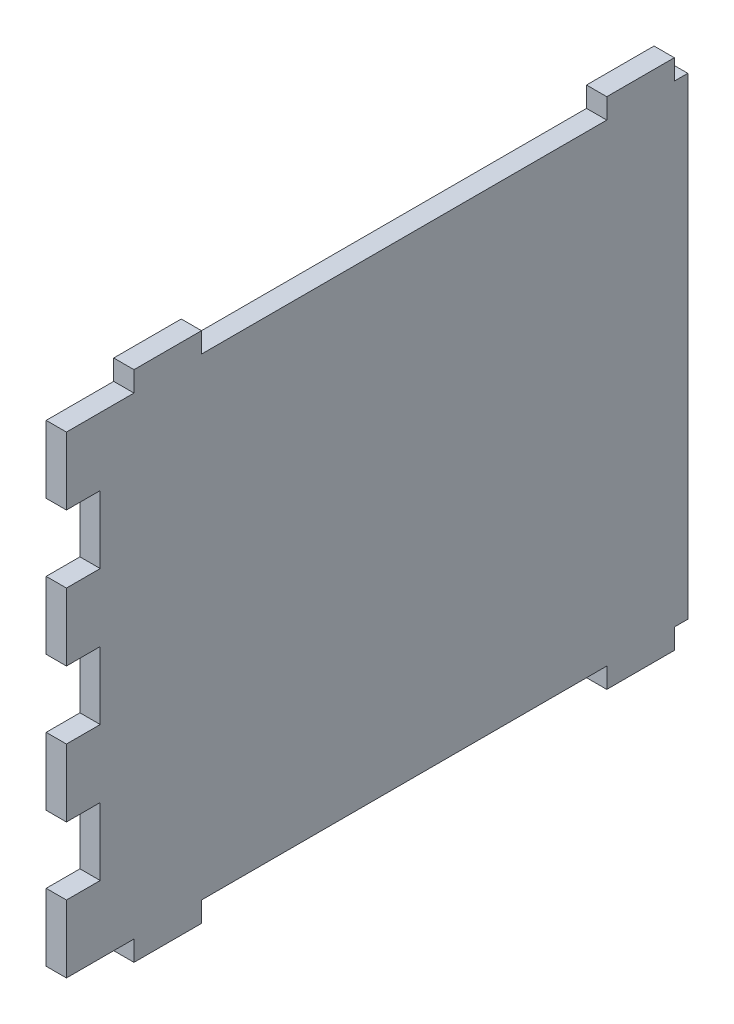
from build123d import *

# Parameters (mm, degrees)
ESBO_O1_W                = 10
ESBO_O1_H                = 3
ESBO_O1_W_2              = 80
ESBO_O1_H_2              = 70
RESSALTO_EXTRUS_O1_DEPTH = 3
ESBO_O2_W                = 2
ESBO_O2_H                = 70
RESSALTO_EXTRUS_O2_DEPTH = 3
ESBO_O3_W                = 5
ESBO_O3_H                = 70
RESSALTO_EXTRUS_O3_DEPTH = 3
ESBO_O4_W                = 5
ESBO_O4_H                = 10
RESSALTO_EXTRUS_O4_DEPTH = 3


with BuildPart() as part:
    # Esboço1 → Ressalto-extrusão1 (new body)
    with BuildSketch(Plane(origin=(0, 0, 0), x_dir=(0, 0, -1), z_dir=(1, 0, 0))):
        with Locations((-35, 36.5)):
            Rectangle(ESBO_O1_W, ESBO_O1_H)
        with Locations((35, 36.5)):
            Rectangle(ESBO_O1_W, ESBO_O1_H)
        with Locations((35, -36.5)):
            Rectangle(ESBO_O1_W, ESBO_O1_H)
        with Locations((-35, -36.5)):
            Rectangle(ESBO_O1_W, ESBO_O1_H)
        Rectangle(ESBO_O1_W_2, ESBO_O1_H_2)
    extrude(amount=RESSALTO_EXTRUS_O1_DEPTH)

    # Esboço2 → Ressalto-extrusão2 (add)
    with BuildSketch(Plane(origin=(3, 0, 0), x_dir=(0, 0, -1), z_dir=(1, 0, 0))):
        with Locations((41, 0)):
            Rectangle(ESBO_O2_W, ESBO_O2_H)
    extrude(amount=-RESSALTO_EXTRUS_O2_DEPTH)

    # Esboço3 → Ressalto-extrusão3 (add)
    with BuildSketch(Plane(origin=(3, 0, 0), x_dir=(0, 0, -1), z_dir=(1, 0, 0))):
        with Locations((-42.5, 0)):
            Rectangle(ESBO_O3_W, ESBO_O3_H)
    extrude(amount=-RESSALTO_EXTRUS_O3_DEPTH)

    # Esboço4 → Ressalto-extrusão4 (add)
    with BuildSketch(Plane(origin=(3, 0, 0), x_dir=(0, 0, -1), z_dir=(1, 0, 0))):
        with Locations((-47.5, 30)):
            Rectangle(ESBO_O4_W, ESBO_O4_H)
        with Locations((-47.5, 10)):
            Rectangle(ESBO_O4_W, ESBO_O4_H)
        with Locations((-47.5, -10)):
            Rectangle(ESBO_O4_W, ESBO_O4_H)
        with Locations((-47.5, -30)):
            Rectangle(ESBO_O4_W, ESBO_O4_H)
    extrude(amount=-RESSALTO_EXTRUS_O4_DEPTH)


solid = part.part
